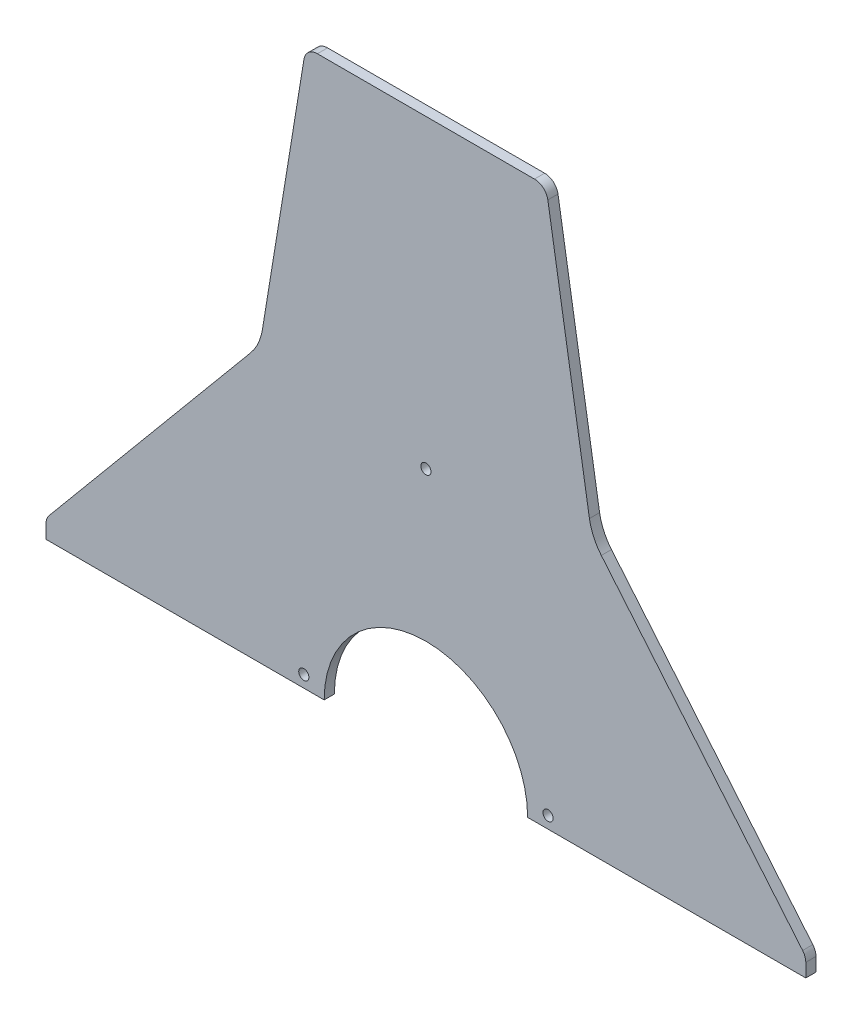
from build123d import *

# Parameters (mm, degrees)
BASE_EXTRUDE_DEPTH = 9.525
SKETCH4_R          = 4.7625
CUT_EXTRUDE1_DEPTH = 751.113488497


with BuildPart() as part:
    # Sketch1 → Base-Extrude (new body)
    with BuildSketch(Plane.XY.offset(130.175)):
        with BuildLine():
            Line((-114.134574641, 649.743144285), (-153.061701436, 410.92742286))
            ThreePointArc((-153.061701436, 410.92742286), (-156.988617271, 398.001466727), (-164.183568949, 386.567583735))
            Line((-164.183568949, 386.567583735), (-352.654107763, 160.533104066))
            ThreePointArc((-352.654107763, 160.533104066), (-354.840836834, 156.72509141), (-355.6, 152.4))
            Line((-355.6, 152.4), (-355.6, 139.7))
            Line((-355.6, 139.7), (-95.25, 139.7))
            ThreePointArc((-95.25, 139.7), (0, 234.95), (95.25, 139.7))
            Line((95.25, 139.7), (355.6, 139.7))
            Line((355.6, 139.7), (355.6, 152.4))
            ThreePointArc((355.6, 152.4), (354.840836834, 156.72509141), (352.654107763, 160.533104066))
            Line((352.654107763, 160.533104066), (164.183568949, 386.567583735))
            ThreePointArc((164.183568949, 386.567583735), (156.988617271, 398.001466727), (153.061701436, 410.92742286))
            Line((153.061701436, 410.92742286), (114.134574641, 649.743144285))
            ThreePointArc((114.134574641, 649.743144285), (109.826240562, 657.375689444), (101.6, 660.4))
            Line((101.6, 660.4), (-101.6, 660.4))
            ThreePointArc((-101.6, 660.4), (-109.826240562, 657.375689444), (-114.134574641, 649.743144285))
        make_face()
    extrude(amount=BASE_EXTRUDE_DEPTH)

    # Sketch4 → Cut-Extrude1 (cut, through all)
    with BuildSketch(Plane.XY.offset(139.7)):
        with Locations((0, 374.65)):
            Circle(SKETCH4_R)
        with Locations((114.3, 150.8252)):
            Circle(SKETCH4_R)
        with Locations(Location((-114.3, 150.8252, 0), (0, 0, 180))):
            Circle(SKETCH4_R)
    extrude(amount=-CUT_EXTRUDE1_DEPTH, mode=Mode.SUBTRACT)


solid = part.part
